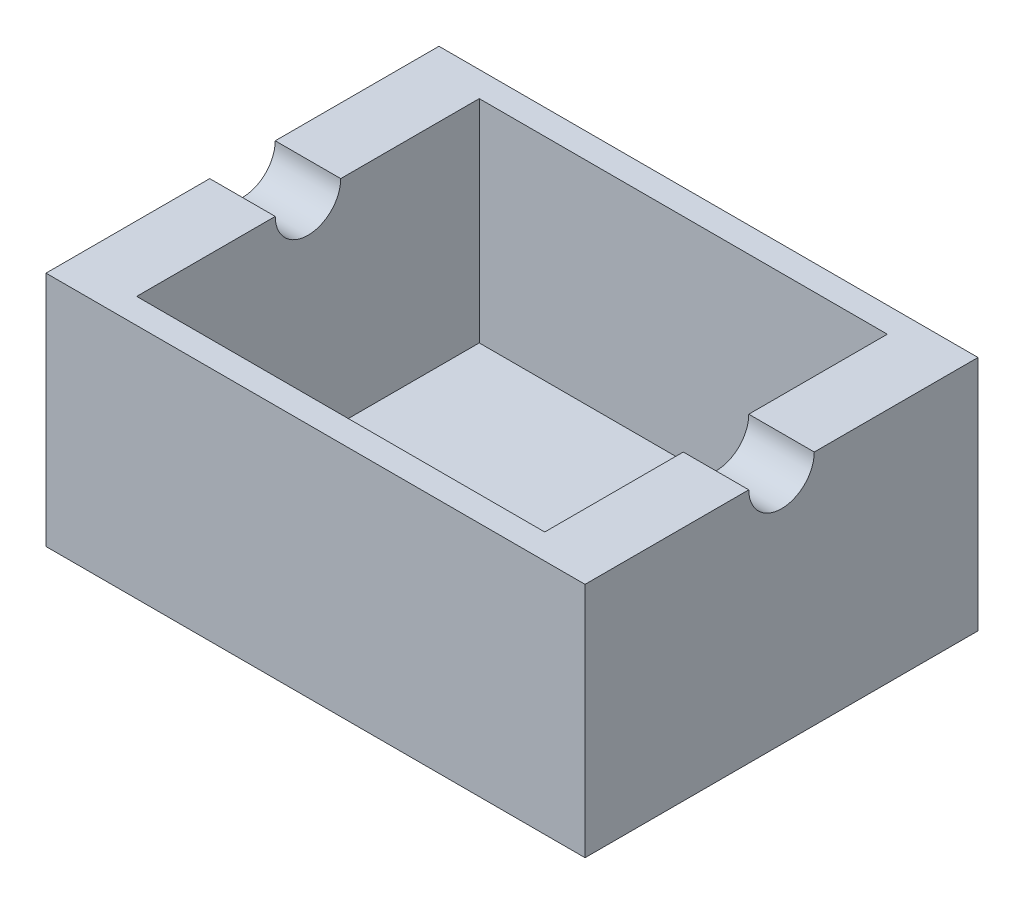
from build123d import *

# Parameters (mm, degrees)
CROQUIS1_W              = 42.8
CROQUIS1_H              = 31.2
CROQUIS1_W_2            = 32.4
CROQUIS1_H_2            = 27.2
SALIENTE_EXTRUIR1_DEPTH = 16.8
CROQUIS1_2_W            = 42.8
CROQUIS1_2_H            = 31.2
CROQUIS1_2_W_2          = 32.4
CROQUIS1_2_H_2          = 27.2
SALIENTE_EXTRUIR2_DEPTH = 2
CORTAR_EXTRUIR1_REACH   = 50.553


with BuildPart() as part:
    # Croquis1 → Saliente-Extruir1 (new body)
    with BuildSketch(Plane(origin=(0, 0, 0), x_dir=(1, 0, 0), z_dir=(0, 1, 0))):
        Rectangle(CROQUIS1_W, CROQUIS1_H)
        Rectangle(CROQUIS1_W_2, CROQUIS1_H_2, mode=Mode.SUBTRACT)
    extrude(amount=SALIENTE_EXTRUIR1_DEPTH)

    # Croquis1<2> → Saliente-Extruir2 (add)
    # profile 1 of 2: a face of its own
    with BuildSketch(Plane(origin=(0, 0, 0), x_dir=(1, 0, 0), z_dir=(0, 1, 0))):
        Rectangle(CROQUIS1_2_W, CROQUIS1_2_H)
        Rectangle(CROQUIS1_2_W_2, CROQUIS1_2_H_2, mode=Mode.SUBTRACT)
    # profile 2 of 2: a face of its own
    with BuildSketch(Plane(origin=(0, 0, 0), x_dir=(1, 0, 0), z_dir=(0, 1, 0))):
        Rectangle(CROQUIS1_2_W_2, CROQUIS1_2_H_2)
    extrude(amount=-SALIENTE_EXTRUIR2_DEPTH)

    # Cortar-Extruir1: up to this face of the body (flat: up to its plane)
    cortar_extruir1_end = Plane(part.part.faces().sort_by_distance((-21.4, 7.4, 0))[0])
    # Croquis2 → Cortar-Extruir1 (cut, up to the picked face)
    with BuildSketch(Plane(origin=(21.4, 0, 0), x_dir=(0, 0, -1), z_dir=(1, 0, 0)), mode=Mode.PRIVATE) as cortar_extruir1_sk1:
        with BuildLine():
            Line((-2.6, 16.8), (2.6, 16.8))
            ThreePointArc((2.6, 16.8), (0, 14.2), (-2.6, 16.8))
        make_face()
    cortar_extruir1_tool1 = split(extrude(cortar_extruir1_sk1.sketch, amount=-CORTAR_EXTRUIR1_REACH, mode=Mode.PRIVATE), bisect_by=cortar_extruir1_end, keep=Keep.BOTH, mode=Mode.PRIVATE)
    add(cortar_extruir1_tool1.solids().sort_by(Axis((21.4, 15.696526, 0), (-1, 0, 0)))[0], mode=Mode.SUBTRACT)


solid = part.part
